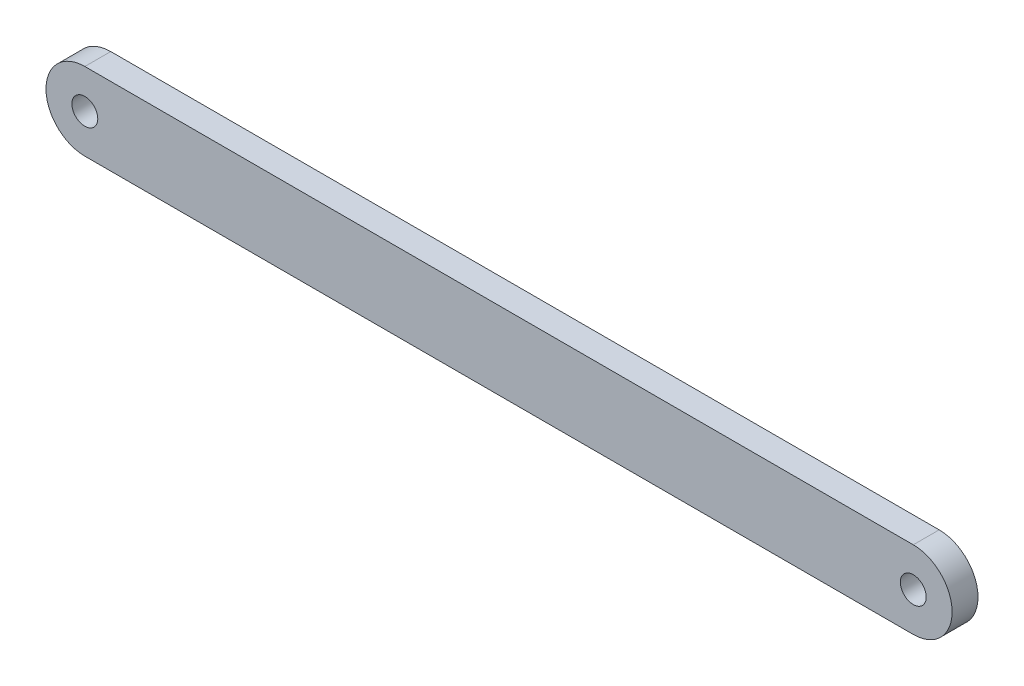
from build123d import *

# Parameters (mm, degrees)
SKETCH1_R           = 4.7625
SKETCH1_R_2         = 1.5875
BOSS_EXTRUDE1_DEPTH = 3.175


with BuildPart() as part:
    # Sketch1 → Boss-Extrude1 (new body)
    # profile 1 of 3: a face of its own
    with BuildSketch(Plane.XY):
        with BuildLine():
            Line((101.6, 4.7625), (0, 4.7625))
            ThreePointArc((0, 4.7625), (3.367596045, 3.367596045), (4.7625, 0))
            ThreePointArc((4.7625, 0), (3.367596045, -3.367596045), (0, -4.7625))
            Line((0, -4.7625), (101.6, -4.7625))
            ThreePointArc((101.6, -4.7625), (96.8375, 0), (101.6, 4.7625))
        make_face()
    # profile 2 of 3: a face of its own
    with BuildSketch(Plane.XY):
        Circle(SKETCH1_R)
        Circle(SKETCH1_R_2, mode=Mode.SUBTRACT)
    # profile 3 of 3: a face of its own
    with BuildSketch(Plane.XY):
        with Locations((101.6, 0)):
            Circle(SKETCH1_R)
        with Locations((101.6, 0)):
            Circle(SKETCH1_R_2, mode=Mode.SUBTRACT)
    extrude(amount=BOSS_EXTRUDE1_DEPTH)


solid = part.part
